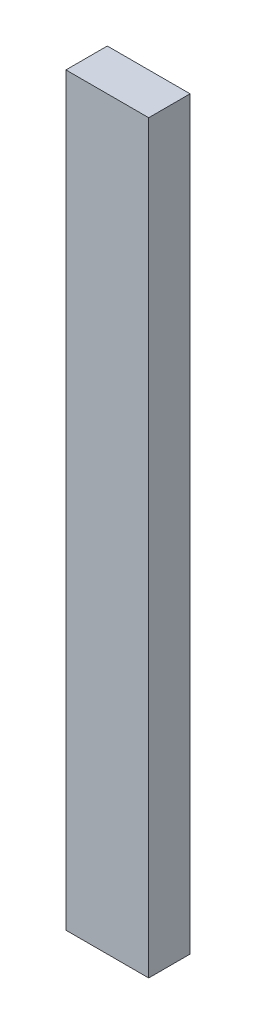
from build123d import *

# Parameters (mm, degrees)
SKETCH1_W           = 25.4
SKETCH1_H           = 228.6
BOSS_EXTRUDE1_DEPTH = 12.7


with BuildPart() as part:
    # Sketch1 → Boss-Extrude1 (new body)
    with BuildSketch(Plane.XY):
        Rectangle(SKETCH1_W, SKETCH1_H)
    extrude(amount=BOSS_EXTRUDE1_DEPTH)


solid = part.part
